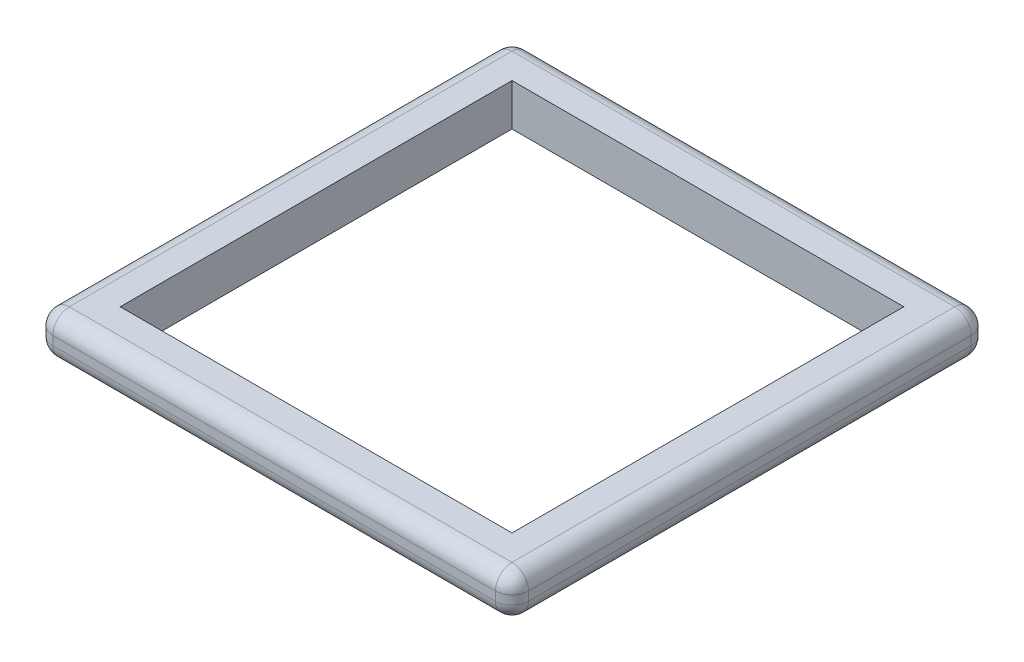
from build123d import *

# Parameters (mm, degrees)
SKETCH1_W           = 863.6
SKETCH1_H           = 863.6
SKETCH1_W_2         = 711.2
SKETCH1_H_2         = 711.2
EXTRUDE_THIN1_DEPTH = 76.2
FILLET1_R           = 30


with BuildPart() as part:
    # Sketch1 → Extrude-Thin1 (new body)
    with BuildSketch(Plane(origin=(0, 0, 0), x_dir=(1, 0, 0), z_dir=(0, 1, 0))):
        with Locations((-355.6, -355.6)):
            Rectangle(SKETCH1_W, SKETCH1_H)
        with Locations((-355.6, -355.6)):
            Rectangle(SKETCH1_W_2, SKETCH1_H_2, mode=Mode.SUBTRACT)
    extrude(amount=EXTRUDE_THIN1_DEPTH)

    # Fillet1
    fillet1_edges = [part.edges().sort_by_distance(p)[0] for p in [
        (-787.4, 76.2, 355.6),
        (-355.6, 76.2, 787.4),
        (-355.6, 0, 787.4),
        (-787.4, 0, 355.6),
        (-355.6, 0, -76.2),
        (76.2, 0, 355.6),
        (76.2, 76.2, 355.6),
        (76.2, 38.1, 787.4),
        (-787.4, 38.1, 787.4),
        (-787.4, 38.1, -76.2),
        (76.2, 38.1, -76.2),
        (-355.6, 76.2, -76.2),
    ]]
    fillet(fillet1_edges, radius=FILLET1_R)


solid = part.part
